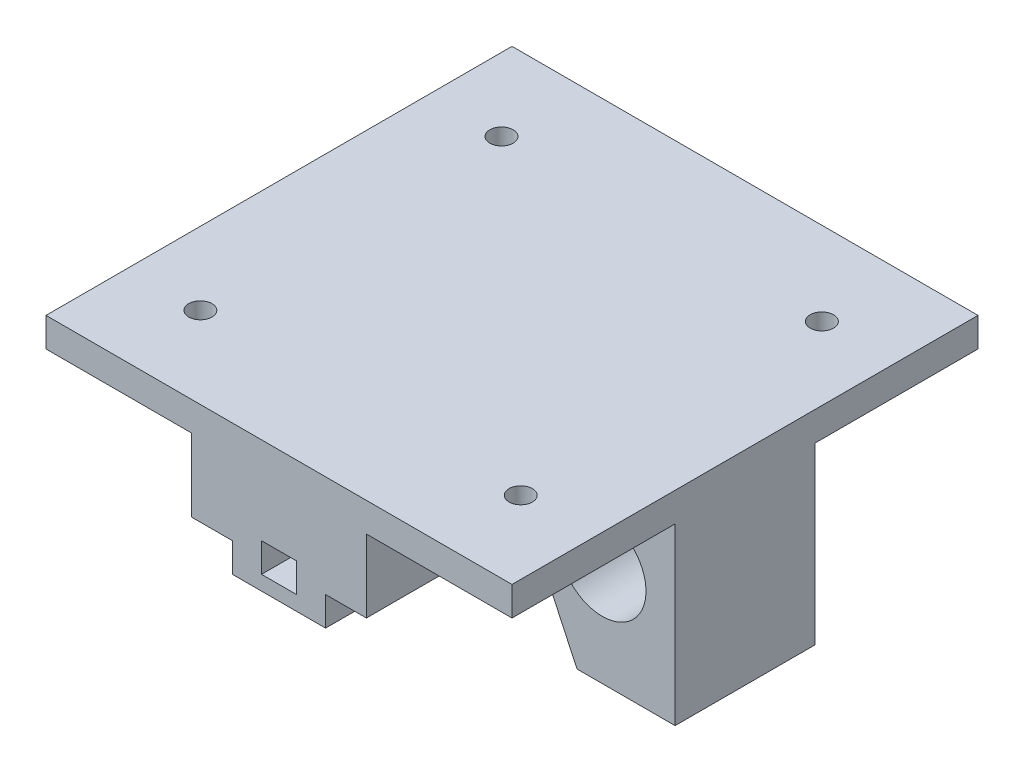
from build123d import *

# Parameters (mm, degrees)
SKETCH2_R           = 7.5
BOSS_EXTRUDE2_DEPTH = 80
SKETCH5_W           = 16
SKETCH5_H           = 60
CUT_EXTRUDE5_DEPTH  = 5
CUT_EXTRUDE6_DEPTH  = 28
CUT_EXTRUDE7_DEPTH  = 28
SKETCH8_R           = 2
CUT_EXTRUDE8_DEPTH  = 5


with BuildPart() as part:
    # Sketch2 → Boss-Extrude2 (new body)
    with BuildSketch(Plane.XY):
        Polygon((8, 0), (15, 0), (23.160384018, -17.5), (40, -17.5), (40, 17.5), (0, 17.5), (-40, 17.5), (-40, -17.5), (-23.160384018, -17.5), (-15, 0), (-8, 0), (-8, -5), (8, -5), align=None)
        with Locations((-27.5, 0)):
            Circle(SKETCH2_R, mode=Mode.SUBTRACT)
        with Locations((27.5, 0)):
            Circle(SKETCH2_R, mode=Mode.SUBTRACT)
        Polygon((-3, 0), (-3, -2.5), (3, -2.5), (3, 0), (3, 2.5), (-3, 2.5), align=None, mode=Mode.SUBTRACT)
    extrude(amount=-BOSS_EXTRUDE2_DEPTH)

    # Sketch5 → Cut-Extrude5 (cut)
    with BuildSketch(Plane(origin=(0, -5, 0), x_dir=(-1, 0, 0), z_dir=(0, -1, 0))):
        with Locations((0, 40)):
            Rectangle(SKETCH5_W, SKETCH5_H)
    extrude(amount=-CUT_EXTRUDE5_DEPTH, mode=Mode.SUBTRACT)

    # Sketch6 → Cut-Extrude6 (cut)
    with BuildSketch(Plane.XY):
        Polygon((-40, 12.5), (-40, -17.5), (-23.160384018, -17.5), (-15, 0), (-15, 12.5), align=None)
        Polygon((40, 12.5), (40, -17.5), (23.160384018, -17.5), (15, 0), (15, 12.5), align=None)
    extrude(amount=-CUT_EXTRUDE6_DEPTH, mode=Mode.SUBTRACT)

    # Sketch7 → Cut-Extrude7 (cut)
    with BuildSketch(Plane(origin=(0, 0, -80), x_dir=(-1, 0, 0), z_dir=(0, 0, -1))):
        Polygon((-40, 12.5), (-40, -17.5), (-23.160384018, -17.5), (-15, 0), (-15, 12.5), align=None)
        Polygon((40, 12.5), (40, -17.5), (23.160384018, -17.5), (15, 0), (15, 12.5), align=None)
    extrude(amount=-CUT_EXTRUDE7_DEPTH, mode=Mode.SUBTRACT)

    # Sketch8 → Cut-Extrude8 (cut)
    with BuildSketch(Plane(origin=(0, 17.5, 0), x_dir=(1, 0, 0), z_dir=(0, 1, 0))):
        with Locations(Location((27.5, 14, 0), (0, 0, 270))):
            Circle(SKETCH8_R)
        with Locations(Location((-27.5, 14, 0), (0, 0, 270))):
            Circle(SKETCH8_R)
        with Locations(Location((-27.5, 65.697240355, 0), (0, 0, 270))):
            Circle(SKETCH8_R)
        with Locations(Location((27.5, 65.697240355, 0), (0, 0, 270))):
            Circle(SKETCH8_R)
    extrude(amount=-CUT_EXTRUDE8_DEPTH, mode=Mode.SUBTRACT)


solid = part.part
